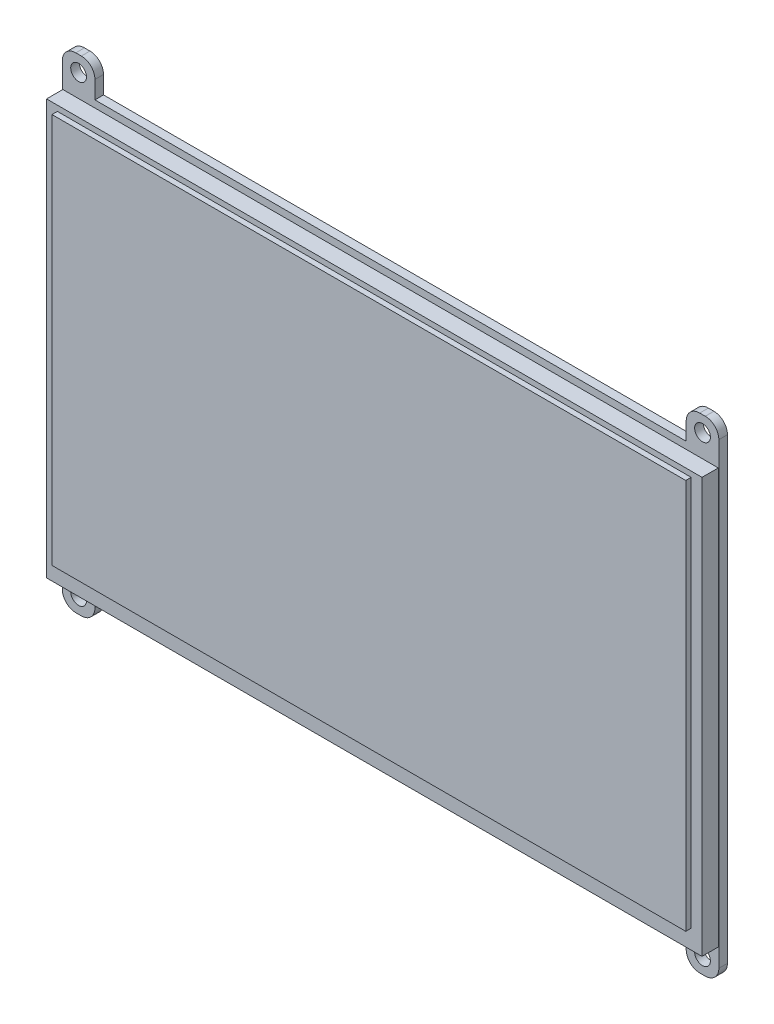
from build123d import *

# Parameters (mm, degrees)
SKETCH1_W           = 121.11
SKETCH1_H           = 77.93
SKETCH1_R           = 1.454399876
BOSS_EXTRUDE1_DEPTH = 1.5875
SKETCH2_W           = 120.91
SKETCH2_H           = 76.529195788
BOSS_EXTRUDE2_DEPTH = 3
SKETCH3_W           = 116.91
SKETCH3_H           = 72.029195788
BOSS_EXTRUDE3_DEPTH = 1


with BuildPart() as part:
    # Sketch1 → Boss-Extrude1 (new body)
    # profile 1 of 5: a face of its own
    with BuildSketch(Plane.XY):
        Rectangle(SKETCH1_W, SKETCH1_H)
    # profile 2 of 5: a face of its own
    with BuildSketch(Plane.XY):
        with BuildLine():
            Line((54.535, 42.225), (54.535, 38.965))
            Line((54.535, 38.965), (60.555, 38.965))
            Line((60.555, 38.965), (60.555, 42.225))
            ThreePointArc((60.555, 42.225), (59.822766953, 43.992766953), (58.055, 44.725))
            Line((58.055, 44.725), (57.035, 44.725))
            ThreePointArc((57.035, 44.725), (55.267233047, 43.992766953), (54.535, 42.225))
        make_face()
        with Locations((57.545, 41.845)):
            Circle(SKETCH1_R, mode=Mode.SUBTRACT)
    # profile 3 of 5: a face of its own
    with BuildSketch(Plane.XY):
        with BuildLine():
            Line((60.555, -38.965), (54.535, -38.965))
            Line((54.535, -38.965), (54.535, -42.225))
            ThreePointArc((54.535, -42.225), (55.267233047, -43.992766953), (57.035, -44.725))
            Line((57.035, -44.725), (58.055, -44.725))
            ThreePointArc((58.055, -44.725), (59.822766953, -43.992766953), (60.555, -42.225))
            Line((60.555, -42.225), (60.555, -38.965))
        make_face()
        with Locations((57.545, -41.845)):
            Circle(SKETCH1_R, mode=Mode.SUBTRACT)
    # profile 4 of 5: a face of its own
    with BuildSketch(Plane.XY):
        with BuildLine():
            Line((-60.555, 42.225), (-60.555, 38.965))
            Line((-60.555, 38.965), (-54.535, 38.965))
            Line((-54.535, 38.965), (-54.535, 42.225))
            ThreePointArc((-54.535, 42.225), (-55.267233047, 43.992766953), (-57.035, 44.725))
            Line((-57.035, 44.725), (-58.055, 44.725))
            ThreePointArc((-58.055, 44.725), (-59.822766953, 43.992766953), (-60.555, 42.225))
        make_face()
        with Locations((-57.545, 41.845)):
            Circle(SKETCH1_R, mode=Mode.SUBTRACT)
    # profile 5 of 5: a face of its own
    with BuildSketch(Plane.XY):
        with BuildLine():
            Line((-54.535, -38.965), (-60.555, -38.965))
            Line((-60.555, -38.965), (-60.555, -42.225))
            ThreePointArc((-60.555, -42.225), (-59.822766953, -43.992766953), (-58.055, -44.725))
            Line((-58.055, -44.725), (-57.035, -44.725))
            ThreePointArc((-57.035, -44.725), (-55.267233047, -43.992766953), (-54.535, -42.225))
            Line((-54.535, -42.225), (-54.535, -38.965))
        make_face()
        with Locations((-57.545, -41.845)):
            Circle(SKETCH1_R, mode=Mode.SUBTRACT)
    extrude(amount=BOSS_EXTRUDE1_DEPTH)

    # Sketch2 → Boss-Extrude2 (add)
    with BuildSketch(Plane.XY.offset(1.5875)):
        with Locations((0, -0.600402106)):
            Rectangle(SKETCH2_W, SKETCH2_H)
    extrude(amount=BOSS_EXTRUDE2_DEPTH)

    # Sketch3 → Boss-Extrude3 (add)
    with BuildSketch(Plane.XY.offset(4.5875)):
        with Locations((0, 0.649597894)):
            Rectangle(SKETCH3_W, SKETCH3_H)
    extrude(amount=BOSS_EXTRUDE3_DEPTH)


solid = part.part
